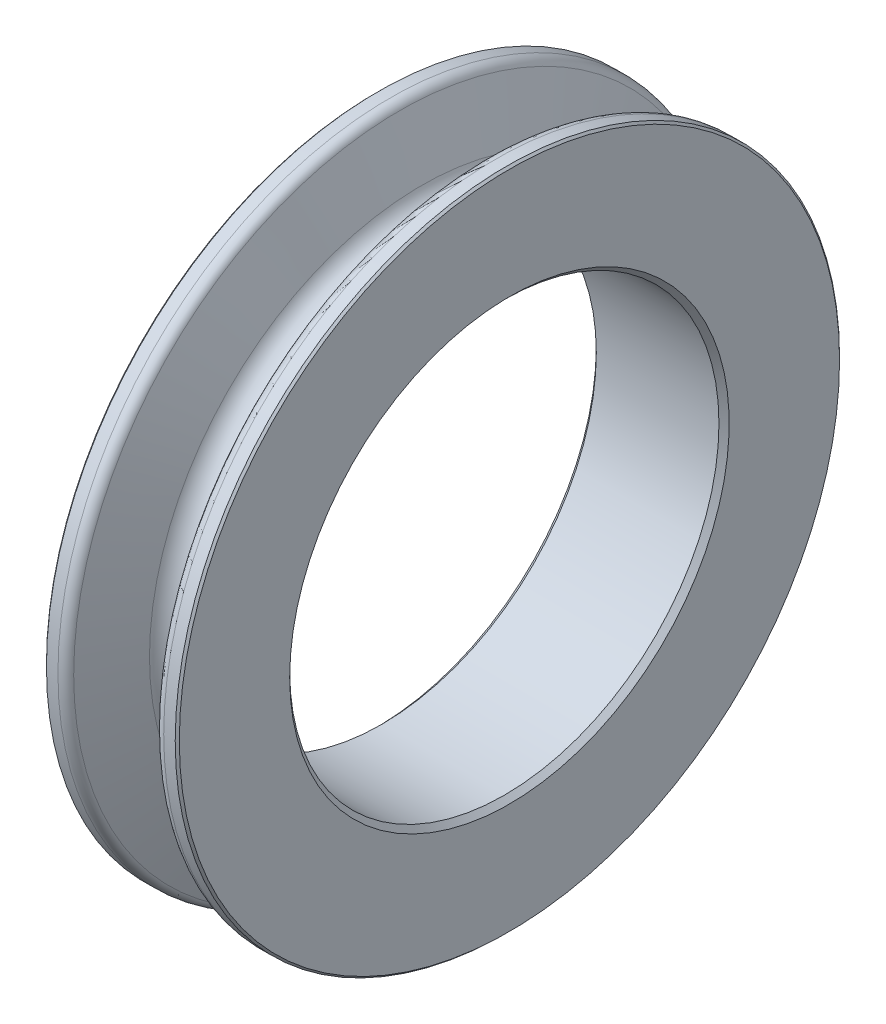
from build123d import *

# Parameters (mm, degrees)
FILETE2_R     = 1
CHANFRO2_SIZE = 0.2
CHANFRO3_SIZE = 0.5


with BuildPart() as part:
    # Esboço1 → Revolução1 (revolve)
    with BuildSketch(Plane.XY, mode=Mode.PRIVATE) as revolu_o1_sk:
        with BuildLine():
            Line((4.506450263, 32.5), (2.078728948, 26.638962277))
            ThreePointArc((2.078728948, 26.638962277), (0, 25.25), (-2.078728948, 26.638962277))
            Line((-2.078728948, 26.638962277), (-4.506450263, 32.5))
            Line((-4.506450263, 32.5), (-6.5, 32.5))
            Line((-6.5, 32.5), (-6.5, 21))
            Line((-6.5, 21), (6.5, 21))
            Line((6.5, 21), (6.5, 32.5))
            Line((6.5, 32.5), (4.506450263, 32.5))
        make_face()
    revolve(revolu_o1_sk.sketch.rotate(Axis((0, 0, 0), (1, 0, 0)), 90), axis=Axis((0, 0, 0), (1, 0, 0)))

    # Filete2
    filete2_edges = [part.edges().sort_by_distance(p)[0] for p in [
        (-4.506450263, 0, -32.5),
        (4.506450263, 0, -32.5),
    ]]
    fillet(filete2_edges, radius=FILETE2_R)

    # Chanfro2
    chanfro2_edges = [part.edges().sort_by_distance(p)[0] for p in [
        (6.5, 0, -32.5),
        (-6.5, 0, -32.5),
    ]]
    chamfer(chanfro2_edges, length=CHANFRO2_SIZE)

    # Chanfro3
    chanfro3_edges = [part.edges().sort_by_distance(p)[0] for p in [
        (6.5, 0, -21),
        (-6.5, 0, -21),
    ]]
    chamfer(chanfro3_edges, length=CHANFRO3_SIZE)


solid = part.part
